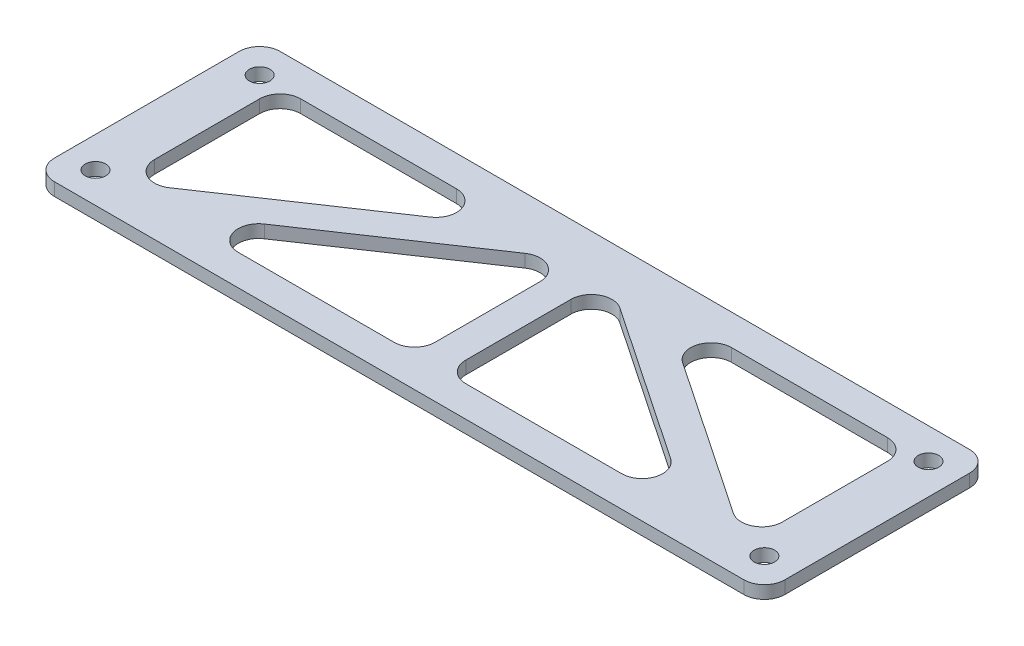
from build123d import *

# Parameters (mm, degrees)
SKETCH1_W           = 142.3995226
SKETCH1_H           = 44
SKETCH1_R           = 2
BOSS_EXTRUDE1_DEPTH = 2.5
FILLET1_R           = 4


with BuildPart() as part:
    # Sketch1 → Boss-Extrude1 (new body)
    with BuildSketch(Plane(origin=(0, 0, 0), x_dir=(1, 0, 0), z_dir=(0, 1, 0))):
        Rectangle(SKETCH1_W, SKETCH1_H)
        with Locations(Location((-65.1997613, 16, 0), (0, 0, 270))):
            Circle(SKETCH1_R, mode=Mode.SUBTRACT)
        with Locations(Location((65.1997613, 16, 0), (0, 0, 270))):
            Circle(SKETCH1_R, mode=Mode.SUBTRACT)
        with Locations(Location((65.1997613, -16, 0), (0, 0, 270))):
            Circle(SKETCH1_R, mode=Mode.SUBTRACT)
        with Locations(Location((-65.1997613, -16, 0), (0, 0, 270))):
            Circle(SKETCH1_R, mode=Mode.SUBTRACT)
        Polygon((-61.1997613, 16), (-61.1997613, -16), (-13.733525191, 16), align=None, mode=Mode.SUBTRACT)
        Polygon((-3, 16), (-50.466236109, -16), (-3, -16), align=None, mode=Mode.SUBTRACT)
        Polygon((3, 16), (3, -16), (50.466236109, -16), align=None, mode=Mode.SUBTRACT)
        Polygon((61.1997613, -16), (13.733525191, 16), (61.1997613, 16), align=None, mode=Mode.SUBTRACT)
    extrude(amount=BOSS_EXTRUDE1_DEPTH)

    # Fillet1
    fillet1_edges = [part.edges().sort_by_distance(p)[0] for p in [
        (-13.733525191, 1.25, -16),
        (-61.1997613, 1.25, -16),
        (-61.1997613, 1.25, 16),
        (-3, 1.25, 16),
        (-3, 1.25, -16),
        (-50.466236109, 1.25, 16),
        (50.466236109, 1.25, 16),
        (3, 1.25, -16),
        (3, 1.25, 16),
        (61.1997613, 1.25, 16),
        (61.1997613, 1.25, -16),
        (13.733525191, 1.25, -16),
        (-71.1997613, 1.25, -22),
        (71.1997613, 1.25, -22),
        (71.1997613, 1.25, 22),
        (-71.1997613, 1.25, 22),
    ]]
    fillet(fillet1_edges, radius=FILLET1_R)


solid = part.part
